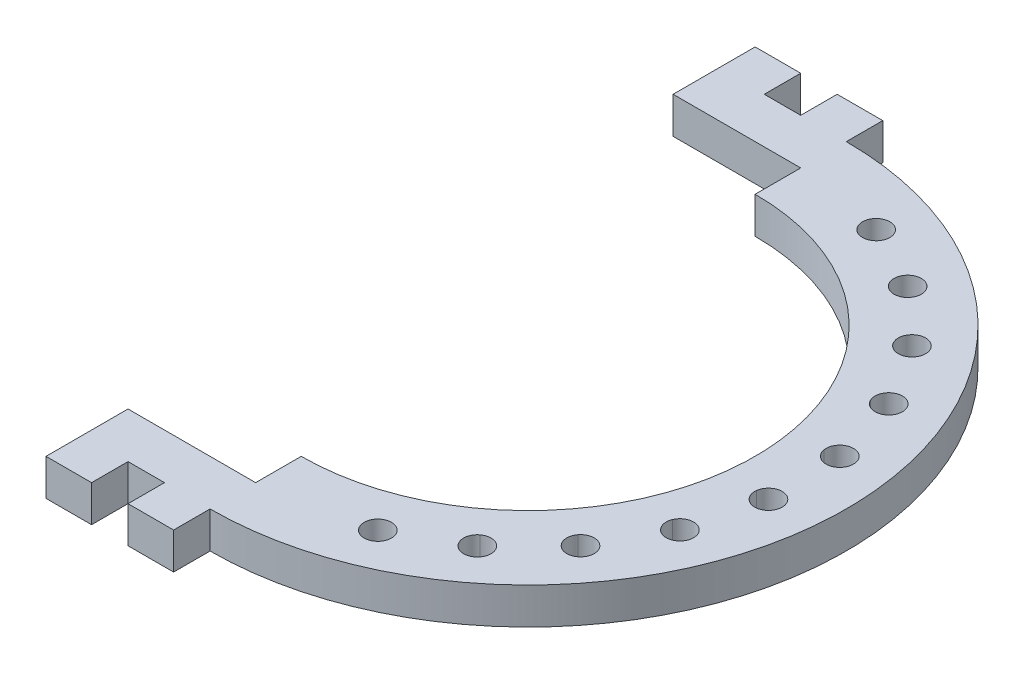
from build123d import *

# Parameters (mm, degrees)
BOSS_EXTRUDE1_DEPTH = 4
SKETCH2_W           = 5
SKETCH2_H           = 4
BOSS_EXTRUDE2_DEPTH = 4
SKETCH3_R           = 1.5
CUT_EXTRUDE1_DEPTH  = 53.413929446
CIRPATTERN2_COUNT   = 9
CIRPATTERN2_ANGLE   = 123.04


with BuildPart() as part:
    # Sketch1 → Boss-Extrude1 (new body)
    with BuildSketch(Plane(origin=(0, 0, 0), x_dir=(1, 0, 0), z_dir=(0, 1, 0))):
        with BuildLine():
            ThreePointArc((0, -34.9), (34.9, 0), (0, 34.9))
            Line((0, 34.9), (0, 24.9))
            ThreePointArc((0, 24.9), (24.9, 0), (0, -24.9))
            Line((0, -24.9), (0, -34.9))
        make_face()
    extrude(amount=BOSS_EXTRUDE1_DEPTH)

    # Sketch2 → Boss-Extrude2 (add, through all)
    with BuildSketch(Plane(origin=(0, 4, 0), x_dir=(1, 0, 0), z_dir=(0, 1, 0))):
        with Locations((-11.5, 36.9)):
            Rectangle(SKETCH2_W, SKETCH2_H)
        Polygon((-14, 29.9), (0, 29.9), (0, 34.9), (-5, 34.9), (-9, 34.9), (-14, 34.9), align=None)
        with Locations((-2.5, 36.9)):
            Rectangle(SKETCH2_W, SKETCH2_H)
        Polygon((-9, -34.9), (-5, -34.9), (0, -34.9), (0, -29.9), (-14, -29.9), (-14, -34.9), align=None)
        with Locations((-11.5, -36.9)):
            Rectangle(SKETCH2_W, SKETCH2_H)
        with Locations((-2.5, -36.9)):
            Rectangle(SKETCH2_W, SKETCH2_H)
    extrude(amount=-BOSS_EXTRUDE2_DEPTH)

    # Sketch3 → Cut-Extrude1 (cut, through all)
    with BuildSketch(Plane(origin=(0, 4, 0), x_dir=(1, 0, 0), z_dir=(0, 1, 0))):
        with Locations(Location((10, 28.17818305, 0), (0, 0, 270))):
            Circle(SKETCH3_R)
        with Locations(Location((17.113605639, 24.518044417, 0), (0, 0, 270))):
            Circle(SKETCH3_R)
    cut_extrude1 = extrude(amount=-CUT_EXTRUDE1_DEPTH, mode=Mode.SUBTRACT)

    # CirPattern2: Cut-Extrude1 ×9 about axis
    cirpattern2_axis = Axis((0, 0, 0), (0, -1, 0))
    for i in range(1, CIRPATTERN2_COUNT):
        add(cut_extrude1.rotate(cirpattern2_axis, i * CIRPATTERN2_ANGLE / (CIRPATTERN2_COUNT - 1)), mode=Mode.SUBTRACT)


solid = part.part
